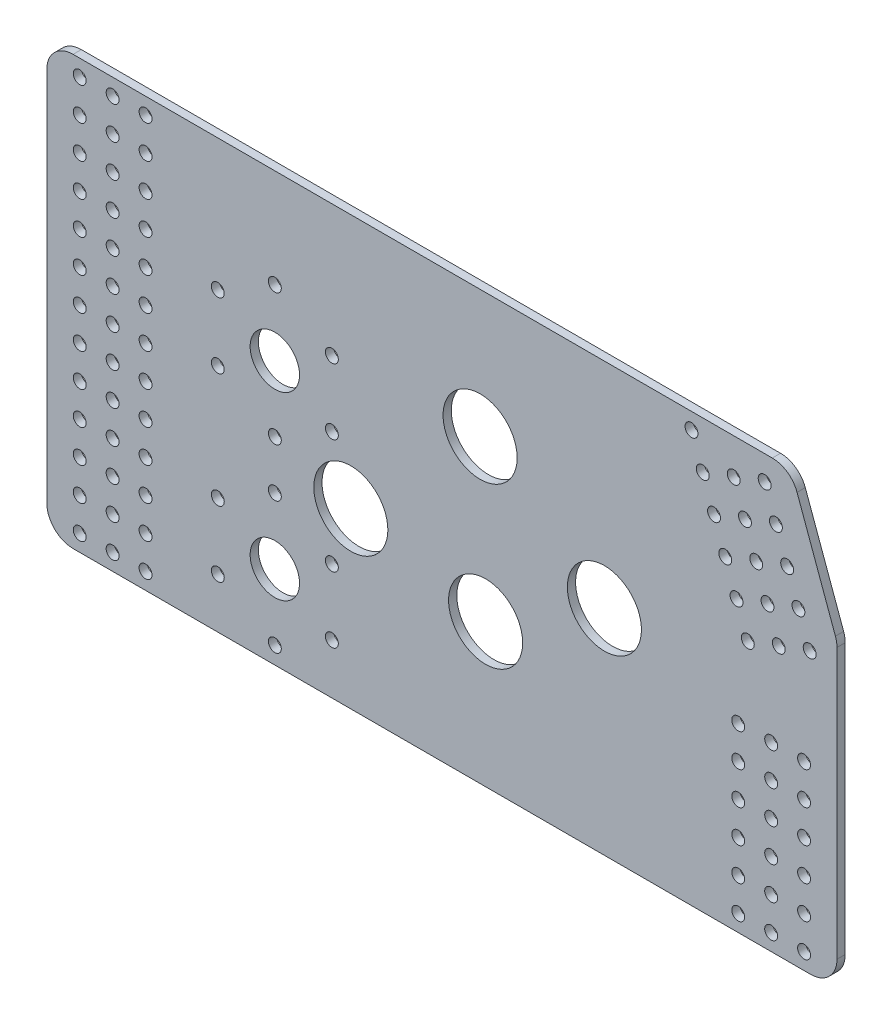
from build123d import *

# Parameters (mm, degrees)
SKETCH1_R           = 2.4892
SKETCH1_R_2         = 14.2875
SKETCH1_R_3         = 9.525
BOSS_EXTRUDE1_DEPTH = 3.175
FILLET1_R           = 10.16


with BuildPart() as part:
    # Sketch1 → Boss-Extrude1 (new body)
    with BuildSketch(Plane.XY):
        Polygon((0, 0), (304.8, 0), (304.8, 116.084254136), (286.959727495, 165.1), (0, 165.1), align=None)
        with Locations((12.7, 158.75)):
            Circle(SKETCH1_R, mode=Mode.SUBTRACT)
        with Locations((38.1, 6.35)):
            Circle(SKETCH1_R, mode=Mode.SUBTRACT)
        with Locations((25.4, 158.75)):
            Circle(SKETCH1_R, mode=Mode.SUBTRACT)
        with Locations((38.1, 158.75)):
            Circle(SKETCH1_R, mode=Mode.SUBTRACT)
        with Locations((25.4, 146.05)):
            Circle(SKETCH1_R, mode=Mode.SUBTRACT)
        with Locations((38.1, 146.05)):
            Circle(SKETCH1_R, mode=Mode.SUBTRACT)
        with Locations((25.4, 133.35)):
            Circle(SKETCH1_R, mode=Mode.SUBTRACT)
        with Locations((38.1, 133.35)):
            Circle(SKETCH1_R, mode=Mode.SUBTRACT)
        with Locations((25.4, 120.65)):
            Circle(SKETCH1_R, mode=Mode.SUBTRACT)
        with Locations((38.1, 120.65)):
            Circle(SKETCH1_R, mode=Mode.SUBTRACT)
        with Locations((25.4, 107.95)):
            Circle(SKETCH1_R, mode=Mode.SUBTRACT)
        with Locations((38.1, 107.95)):
            Circle(SKETCH1_R, mode=Mode.SUBTRACT)
        with Locations((25.4, 95.25)):
            Circle(SKETCH1_R, mode=Mode.SUBTRACT)
        with Locations((38.1, 95.25)):
            Circle(SKETCH1_R, mode=Mode.SUBTRACT)
        with Locations((25.4, 82.55)):
            Circle(SKETCH1_R, mode=Mode.SUBTRACT)
        with Locations((38.1, 82.55)):
            Circle(SKETCH1_R, mode=Mode.SUBTRACT)
        with Locations((25.4, 69.85)):
            Circle(SKETCH1_R, mode=Mode.SUBTRACT)
        with Locations((38.1, 69.85)):
            Circle(SKETCH1_R, mode=Mode.SUBTRACT)
        with Locations((25.4, 57.15)):
            Circle(SKETCH1_R, mode=Mode.SUBTRACT)
        with Locations((38.1, 57.15)):
            Circle(SKETCH1_R, mode=Mode.SUBTRACT)
        with Locations((25.4, 44.45)):
            Circle(SKETCH1_R, mode=Mode.SUBTRACT)
        with Locations((38.1, 44.45)):
            Circle(SKETCH1_R, mode=Mode.SUBTRACT)
        with Locations((25.4, 31.75)):
            Circle(SKETCH1_R, mode=Mode.SUBTRACT)
        with Locations((38.1, 31.75)):
            Circle(SKETCH1_R, mode=Mode.SUBTRACT)
        with Locations((25.4, 19.05)):
            Circle(SKETCH1_R, mode=Mode.SUBTRACT)
        with Locations((38.1, 19.05)):
            Circle(SKETCH1_R, mode=Mode.SUBTRACT)
        with Locations((25.4, 6.35)):
            Circle(SKETCH1_R, mode=Mode.SUBTRACT)
        with Locations((12.7, 146.05)):
            Circle(SKETCH1_R, mode=Mode.SUBTRACT)
        with Locations((12.7, 133.35)):
            Circle(SKETCH1_R, mode=Mode.SUBTRACT)
        with Locations((12.7, 120.65)):
            Circle(SKETCH1_R, mode=Mode.SUBTRACT)
        with Locations((12.7, 107.95)):
            Circle(SKETCH1_R, mode=Mode.SUBTRACT)
        with Locations((12.7, 95.25)):
            Circle(SKETCH1_R, mode=Mode.SUBTRACT)
        with Locations((12.7, 82.55)):
            Circle(SKETCH1_R, mode=Mode.SUBTRACT)
        with Locations((12.7, 69.85)):
            Circle(SKETCH1_R, mode=Mode.SUBTRACT)
        with Locations((12.7, 57.15)):
            Circle(SKETCH1_R, mode=Mode.SUBTRACT)
        with Locations((12.7, 44.45)):
            Circle(SKETCH1_R, mode=Mode.SUBTRACT)
        with Locations((12.7, 31.75)):
            Circle(SKETCH1_R, mode=Mode.SUBTRACT)
        with Locations((12.7, 19.05)):
            Circle(SKETCH1_R, mode=Mode.SUBTRACT)
        with Locations((12.7, 6.35)):
            Circle(SKETCH1_R, mode=Mode.SUBTRACT)
        with Locations((248.678017777, 158.881185382)):
            Circle(SKETCH1_R, mode=Mode.SUBTRACT)
        with Locations((264.955769881, 151.290744918)):
            Circle(SKETCH1_R, mode=Mode.SUBTRACT)
        with Locations((276.889866165, 155.634400739)):
            Circle(SKETCH1_R, mode=Mode.SUBTRACT)
        with Locations((253.021673597, 146.947089098)):
            Circle(SKETCH1_R, mode=Mode.SUBTRACT)
        with Locations((269.299425702, 139.356648634)):
            Circle(SKETCH1_R, mode=Mode.SUBTRACT)
        with Locations((281.233521986, 143.700304455)):
            Circle(SKETCH1_R, mode=Mode.SUBTRACT)
        with Locations((257.365329418, 135.012992814)):
            Circle(SKETCH1_R, mode=Mode.SUBTRACT)
        with Locations((273.643081522, 127.42255235)):
            Circle(SKETCH1_R, mode=Mode.SUBTRACT)
        with Locations((285.577177806, 131.766208171)):
            Circle(SKETCH1_R, mode=Mode.SUBTRACT)
        with Locations((261.708985238, 123.07889653)):
            Circle(SKETCH1_R, mode=Mode.SUBTRACT)
        with Locations((277.986737342, 115.488456066)):
            Circle(SKETCH1_R, mode=Mode.SUBTRACT)
        with Locations((289.920833626, 119.832111887)):
            Circle(SKETCH1_R, mode=Mode.SUBTRACT)
        with Locations((266.052641058, 111.144800246)):
            Circle(SKETCH1_R, mode=Mode.SUBTRACT)
        with Locations((282.330393162, 103.554359782)):
            Circle(SKETCH1_R, mode=Mode.SUBTRACT)
        with Locations((294.264489446, 107.898015603)):
            Circle(SKETCH1_R, mode=Mode.SUBTRACT)
        with Locations((270.396296878, 99.210703962)):
            Circle(SKETCH1_R, mode=Mode.SUBTRACT)
        with Locations((279.4, 69.85)):
            Circle(SKETCH1_R, mode=Mode.SUBTRACT)
        with Locations((266.7, 69.85)):
            Circle(SKETCH1_R, mode=Mode.SUBTRACT)
        with Locations((292.1, 69.85)):
            Circle(SKETCH1_R, mode=Mode.SUBTRACT)
        with Locations((266.7, 57.15)):
            Circle(SKETCH1_R, mode=Mode.SUBTRACT)
        with Locations((279.4, 57.15)):
            Circle(SKETCH1_R, mode=Mode.SUBTRACT)
        with Locations((292.1, 57.15)):
            Circle(SKETCH1_R, mode=Mode.SUBTRACT)
        with Locations((266.7, 44.45)):
            Circle(SKETCH1_R, mode=Mode.SUBTRACT)
        with Locations((279.4, 44.45)):
            Circle(SKETCH1_R, mode=Mode.SUBTRACT)
        with Locations((292.1, 44.45)):
            Circle(SKETCH1_R, mode=Mode.SUBTRACT)
        with Locations((266.7, 31.75)):
            Circle(SKETCH1_R, mode=Mode.SUBTRACT)
        with Locations((279.4, 31.75)):
            Circle(SKETCH1_R, mode=Mode.SUBTRACT)
        with Locations((292.1, 31.75)):
            Circle(SKETCH1_R, mode=Mode.SUBTRACT)
        with Locations((266.7, 19.05)):
            Circle(SKETCH1_R, mode=Mode.SUBTRACT)
        with Locations((279.4, 19.05)):
            Circle(SKETCH1_R, mode=Mode.SUBTRACT)
        with Locations((292.1, 19.05)):
            Circle(SKETCH1_R, mode=Mode.SUBTRACT)
        with Locations((266.7, 6.35)):
            Circle(SKETCH1_R, mode=Mode.SUBTRACT)
        with Locations((279.4, 6.35)):
            Circle(SKETCH1_R, mode=Mode.SUBTRACT)
        with Locations((292.1, 6.35)):
            Circle(SKETCH1_R, mode=Mode.SUBTRACT)
        with Locations((117.275545981, 66.937360953)):
            Circle(SKETCH1_R_2, mode=Mode.SUBTRACT)
        with Locations((167.147605731, 115.915231493)):
            Circle(SKETCH1_R_2, mode=Mode.SUBTRACT)
        with Locations((169.269677971, 55.177793896)):
            Circle(SKETCH1_R_2, mode=Mode.SUBTRACT)
        with Locations((215.081758022, 82.498279276)):
            Circle(SKETCH1_R_2, mode=Mode.SUBTRACT)
        with Locations((87.96680696, 101.664655725)):
            Circle(SKETCH1_R_3, mode=Mode.SUBTRACT)
        with Locations((87.96680696, 32.068655725)):
            Circle(SKETCH1_R_3, mode=Mode.SUBTRACT)
        with Locations((87.96680696, 127.064655725)):
            Circle(SKETCH1_R, mode=Mode.SUBTRACT)
        with Locations((109.963852217, 114.364655725)):
            Circle(SKETCH1_R, mode=Mode.SUBTRACT)
        with Locations((109.963852217, 88.964655725)):
            Circle(SKETCH1_R, mode=Mode.SUBTRACT)
        with Locations((87.96680696, 76.264655725)):
            Circle(SKETCH1_R, mode=Mode.SUBTRACT)
        with Locations((65.969761704, 88.964655725)):
            Circle(SKETCH1_R, mode=Mode.SUBTRACT)
        with Locations((65.969761704, 114.364655725)):
            Circle(SKETCH1_R, mode=Mode.SUBTRACT)
        with Locations((87.96680696, 6.668655725)):
            Circle(SKETCH1_R, mode=Mode.SUBTRACT)
        with Locations((65.969761704, 19.368655725)):
            Circle(SKETCH1_R, mode=Mode.SUBTRACT)
        with Locations((65.969761704, 44.768655725)):
            Circle(SKETCH1_R, mode=Mode.SUBTRACT)
        with Locations((87.96680696, 57.468655725)):
            Circle(SKETCH1_R, mode=Mode.SUBTRACT)
        with Locations((109.963852217, 44.768655725)):
            Circle(SKETCH1_R, mode=Mode.SUBTRACT)
        with Locations((109.963852217, 19.368655725)):
            Circle(SKETCH1_R, mode=Mode.SUBTRACT)
    extrude(amount=BOSS_EXTRUDE1_DEPTH)

    # Fillet1
    fillet1_edges = [part.edges().sort_by_distance(p)[0] for p in [
        (286.959727495, 165.1, 1.5875),
        (304.8, 116.084254136, 1.5875),
        (304.8, 0, 1.5875),
        (0, 0, 1.5875),
        (0, 165.1, 1.5875),
    ]]
    fillet(fillet1_edges, radius=FILLET1_R)


solid = part.part
